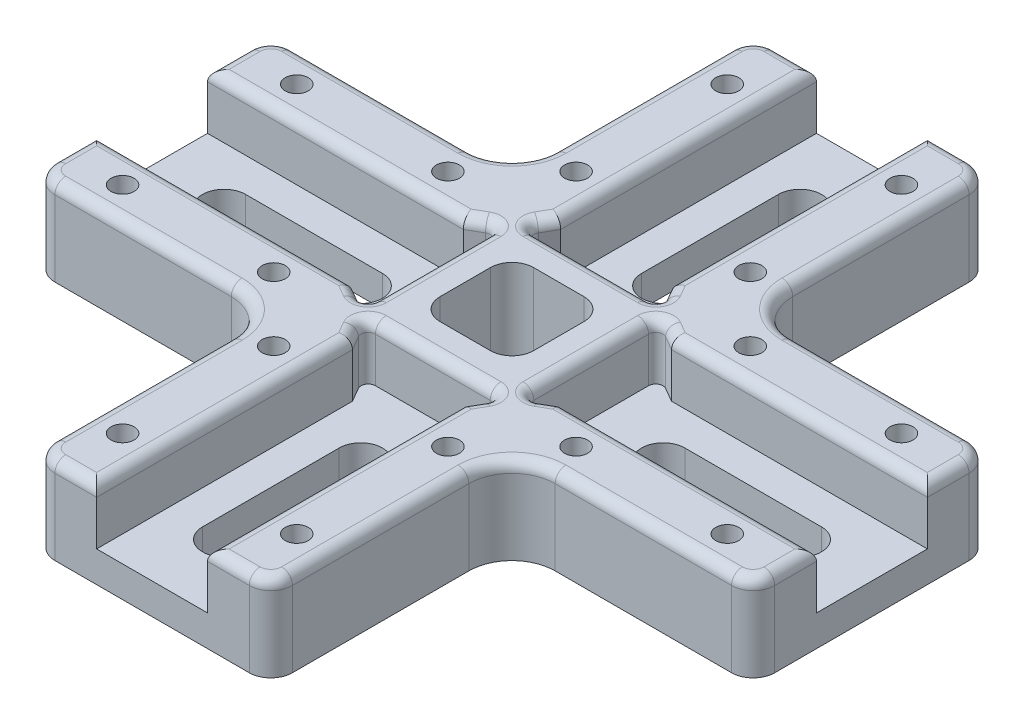
from build123d import *

# Parameters (mm, degrees)
BOSS_EXTRUDE1_DEPTH = 12
CUT_EXTRUDE1_DEPTH  = 7.7
SKETCH5_R           = 1.6
CUT_EXTRUDE2_DEPTH  = 72.721684308
SKETCH7_R           = 3.25
CUT_EXTRUDE3_DEPTH  = 8.5
FILLET1_R           = 6
FILLET3_R           = 3
CUT_EXTRUDE5_DEPTH  = 72.721684308
FILLET5_R           = 1.5


with BuildPart() as part:
    # Sketch1 → Boss-Extrude1 (new body)
    with BuildSketch(Plane(origin=(0, 0, 0), x_dir=(1, 0, 0), z_dir=(0, 1, 0))):
        Polygon((0, 50), (-16.5, 50), (-16.5, 16.5), (-50, 16.5), (-50, 0), (-50, -16.5), (-16.5, -16.5), (-16.5, -50), (0, -50), (16.5, -50), (16.5, -16.5), (50, -16.5), (50, 0), (50, 16.5), (16.5, 16.5), (16.5, 50), align=None)
    extrude(amount=BOSS_EXTRUDE1_DEPTH)

    # Sketch4 → Cut-Extrude1 (cut)
    with BuildSketch(Plane(origin=(0, 12, 0), x_dir=(1, 0, 0), z_dir=(0, 1, 0))):
        with BuildLine():
            Line((50, -7.7), (50, 7.7))
            Line((50, 7.7), (14.464101615, 7.7))
            Line((14.464101615, 7.7), (12.5, 8.833974596))
            ThreePointArc((12.5, 8.833974596), (11.5, 8.833974596), (11, 7.967949192))
            Line((11, 7.967949192), (11, -7.967949192))
            ThreePointArc((11, -7.967949192), (11.5, -8.833974596), (12.5, -8.833974596))
            Line((12.5, -8.833974596), (14.464101615, -7.7))
            Line((14.464101615, -7.7), (50, -7.7))
        make_face()
        with BuildLine():
            Line((7.7, 50), (-7.7, 50))
            Line((-7.7, 50), (-7.7, 14.464101615))
            Line((-7.7, 14.464101615), (-8.833974596, 12.5))
            ThreePointArc((-8.833974596, 12.5), (-8.833974596, 11.5), (-7.967949192, 11))
            Line((-7.967949192, 11), (7.967949192, 11))
            ThreePointArc((7.967949192, 11), (8.833974596, 11.5), (8.833974596, 12.5))
            Line((8.833974596, 12.5), (7.7, 14.464101615))
            Line((7.7, 14.464101615), (7.7, 50))
        make_face()
        with BuildLine():
            Line((-7.7, -50), (7.7, -50))
            Line((7.7, -50), (7.7, -14.464101615))
            Line((7.7, -14.464101615), (8.833974596, -12.5))
            ThreePointArc((8.833974596, -12.5), (8.833974596, -11.5), (7.967949192, -11))
            Line((7.967949192, -11), (-7.967949192, -11))
            ThreePointArc((-7.967949192, -11), (-8.833974596, -11.5), (-8.833974596, -12.5))
            Line((-8.833974596, -12.5), (-7.7, -14.464101615))
            Line((-7.7, -14.464101615), (-7.7, -50))
        make_face()
        with BuildLine():
            Line((-50, 7.7), (-50, -7.7))
            Line((-50, -7.7), (-14.464101615, -7.7))
            Line((-14.464101615, -7.7), (-12.5, -8.833974596))
            ThreePointArc((-12.5, -8.833974596), (-11.5, -8.833974596), (-11, -7.967949192))
            Line((-11, -7.967949192), (-11, 7.967949192))
            ThreePointArc((-11, 7.967949192), (-11.5, 8.833974596), (-12.5, 8.833974596))
            Line((-12.5, 8.833974596), (-14.464101615, 7.7))
            Line((-14.464101615, 7.7), (-50, 7.7))
        make_face()
    extrude(amount=-CUT_EXTRUDE1_DEPTH, mode=Mode.SUBTRACT)

    # Sketch5 → Cut-Extrude2 (cut, through all)
    with BuildSketch(Plane(origin=(0, 12, 0), x_dir=(1, 0, 0), z_dir=(0, 1, 0))):
        with Locations(Location((-12.1, 42, 0), (0, 0, 270))):
            Circle(SKETCH5_R)
        with Locations(Location((-12.1, 21, 0), (0, 0, 270))):
            Circle(SKETCH5_R)
        with Locations(Location((12.1, 21, 0), (0, 0, 90))):
            Circle(SKETCH5_R)
        with Locations(Location((12.1, 42, 0), (0, 0, 90))):
            Circle(SKETCH5_R)
        with Locations(Location((42, 12.1, 0), (0, 0, 270))):
            Circle(SKETCH5_R)
        with Locations(Location((21, 12.1, 0), (0, 0, 270))):
            Circle(SKETCH5_R)
        with Locations(Location((21, -12.1, 0), (0, 0, 90))):
            Circle(SKETCH5_R)
        with Locations(Location((42, -12.1, 0), (0, 0, 90))):
            Circle(SKETCH5_R)
        with Locations(Location((12.1, -42, 0), (0, 0, 270))):
            Circle(SKETCH5_R)
        with Locations(Location((12.1, -21, 0), (0, 0, 270))):
            Circle(SKETCH5_R)
        with Locations(Location((-12.1, -21, 0), (0, 0, 90))):
            Circle(SKETCH5_R)
        with Locations(Location((-12.1, -42, 0), (0, 0, 90))):
            Circle(SKETCH5_R)
        with Locations(Location((-42, -12.1, 0), (0, 0, 270))):
            Circle(SKETCH5_R)
        with Locations(Location((-21, -12.1, 0), (0, 0, 270))):
            Circle(SKETCH5_R)
        with Locations(Location((-21, 12.1, 0), (0, 0, 90))):
            Circle(SKETCH5_R)
        with Locations(Location((-42, 12.1, 0), (0, 0, 90))):
            Circle(SKETCH5_R)
    extrude(amount=-CUT_EXTRUDE2_DEPTH, mode=Mode.SUBTRACT)

    # Sketch7 → Cut-Extrude3 (cut)
    with BuildSketch(Plane.XZ):
        with Locations(Location((-12.1, 42, 0), (0, 0, 270))):
            Circle(SKETCH7_R)
        with Locations(Location((-12.1, 21, 0), (0, 0, 270))):
            Circle(SKETCH7_R)
        with Locations(Location((12.1, 21, 0), (0, 0, 90))):
            Circle(SKETCH7_R)
        with Locations(Location((12.1, 42, 0), (0, 0, 90))):
            Circle(SKETCH7_R)
        with Locations(Location((42, 12.1, 0), (0, 0, 270))):
            Circle(SKETCH7_R)
        with Locations(Location((21, 12.1, 0), (0, 0, 270))):
            Circle(SKETCH7_R)
        with Locations(Location((21, -12.1, 0), (0, 0, 90))):
            Circle(SKETCH7_R)
        with Locations(Location((42, -12.1, 0), (0, 0, 90))):
            Circle(SKETCH7_R)
        with Locations(Location((12.1, -42, 0), (0, 0, 270))):
            Circle(SKETCH7_R)
        with Locations(Location((12.1, -21, 0), (0, 0, 270))):
            Circle(SKETCH7_R)
        with Locations(Location((-12.1, -21, 0), (0, 0, 90))):
            Circle(SKETCH7_R)
        with Locations(Location((-12.1, -42, 0), (0, 0, 90))):
            Circle(SKETCH7_R)
        with Locations(Location((-42, -12.1, 0), (0, 0, 270))):
            Circle(SKETCH7_R)
        with Locations(Location((-21, -12.1, 0), (0, 0, 270))):
            Circle(SKETCH7_R)
        with Locations(Location((-21, 12.1, 0), (0, 0, 90))):
            Circle(SKETCH7_R)
        with Locations(Location((-42, 12.1, 0), (0, 0, 90))):
            Circle(SKETCH7_R)
    extrude(amount=-CUT_EXTRUDE3_DEPTH, mode=Mode.SUBTRACT)

    # Fillet1
    fillet1_edges = [part.edges().sort_by_distance(p)[0] for p in [
        (16.5, 6, -16.5),
        (16.5, 6, 16.5),
        (-16.5, 6, 16.5),
        (-16.5, 6, -16.5),
    ]]
    fillet(fillet1_edges, radius=FILLET1_R)

    # Fillet3
    fillet3_edges = [part.edges().sort_by_distance(p)[0] for p in [
        (16.5, 6, -50),
        (50, 6, -16.5),
        (50, 6, 16.5),
        (16.5, 6, 50),
        (-16.5, 6, 50),
        (-50, 6, 16.5),
        (-50, 6, -16.5),
        (-16.5, 6, -50),
    ]]
    fillet(fillet3_edges, radius=FILLET3_R)

    # Sketch9 → Cut-Extrude5 (cut, through all)
    with BuildSketch(Plane(origin=(0, 12, 0), x_dir=(1, 0, 0), z_dir=(0, 1, 0))):
        with BuildLine():
            Line((3, 40), (3, 21))
            ThreePointArc((3, 21), (0, 18), (-3, 21))
            Line((-3, 21), (-3, 40))
            ThreePointArc((-3, 40), (0, 43), (3, 40))
        make_face()
        with BuildLine():
            Line((-3.5, 6.5), (3.5, 6.5))
            ThreePointArc((3.5, 6.5), (5.621320344, 5.621320344), (6.5, 3.5))
            Line((6.5, 3.5), (6.5, -3.5))
            ThreePointArc((6.5, -3.5), (5.621320344, -5.621320344), (3.5, -6.5))
            Line((3.5, -6.5), (-3.5, -6.5))
            ThreePointArc((-3.5, -6.5), (-5.621320344, -5.621320344), (-6.5, -3.5))
            Line((-6.5, -3.5), (-6.5, 3.5))
            ThreePointArc((-6.5, 3.5), (-5.621320344, 5.621320344), (-3.5, 6.5))
        make_face()
        with BuildLine():
            Line((40, -3), (21, -3))
            ThreePointArc((21, -3), (18, 0), (21, 3))
            Line((21, 3), (40, 3))
            ThreePointArc((40, 3), (43, 0), (40, -3))
        make_face()
        with BuildLine():
            Line((-3, -40), (-3, -21))
            ThreePointArc((-3, -21), (0, -18), (3, -21))
            Line((3, -21), (3, -40))
            ThreePointArc((3, -40), (0, -43), (-3, -40))
        make_face()
        with BuildLine():
            Line((-40, 3), (-21, 3))
            ThreePointArc((-21, 3), (-18, 0), (-21, -3))
            Line((-21, -3), (-40, -3))
            ThreePointArc((-40, -3), (-43, 0), (-40, 3))
        make_face()
    extrude(amount=-CUT_EXTRUDE5_DEPTH, mode=Mode.SUBTRACT)

    # Fillet5
    fillet5_edges = [part.edges().sort_by_distance(p)[0] for p in [
        (-11.5, 12, 8.833974596),
        (-11, 12, 0),
        (-11.5, 12, -8.833974596),
        (-13.482050808, 12, -8.266987298),
        (-32.232050808, 12, -7.7),
        (-32.232050808, 12, 7.7),
        (-13.482050808, 12, 8.266987298),
        (-34.75, 12, -16.5),
        (16.5, 12, -34.75),
        (-16.5, 12, 34.75),
        (34.75, 12, 16.5),
        (-18.257359313, 12, -18.257359313),
        (18.257359313, 12, -18.257359313),
        (-18.257359313, 12, 18.257359313),
        (18.257359313, 12, 18.257359313),
        (-34.75, 12, 16.5),
        (-50, 12, -10.6),
        (-16.5, 12, -34.75),
        (-10.6, 12, 50),
        (16.5, 12, 34.75),
        (50, 12, 10.6),
        (34.75, 12, -16.5),
        (10.6, 12, -50),
        (-15.621320344, 12, 49.121320344),
        (15.621320344, 12, 49.121320344),
        (49.121320344, 12, 15.621320344),
        (49.121320344, 12, -15.621320344),
        (15.621320344, 12, -49.121320344),
        (-15.621320344, 12, -49.121320344),
        (-49.121320344, 12, -15.621320344),
        (-49.121320344, 12, 15.621320344),
        (50, 12, -10.6),
        (11.5, 12, -8.833974596),
        (11, 12, 0),
        (11.5, 12, 8.833974596),
        (13.482050808, 12, 8.266987298),
        (32.232050808, 12, 7.7),
        (32.232050808, 12, -7.7),
        (13.482050808, 12, -8.266987298),
        (-10.6, 12, -50),
        (-50, 12, 10.6),
        (10.6, 12, 50),
        (-8.833974596, 12, -11.5),
        (0, 12, -11),
        (8.833974596, 12, -11.5),
        (8.266987298, 12, -13.482050808),
        (7.7, 12, -32.232050808),
        (-7.7, 12, -32.232050808),
        (-8.266987298, 12, -13.482050808),
        (8.833974596, 12, 11.5),
        (0, 12, 11),
        (-8.833974596, 12, 11.5),
        (-8.266987298, 12, 13.482050808),
        (-7.7, 12, 32.232050808),
        (7.7, 12, 32.232050808),
        (8.266987298, 12, 13.482050808),
    ]]
    fillet(fillet5_edges, radius=FILLET5_R)


solid = part.part
